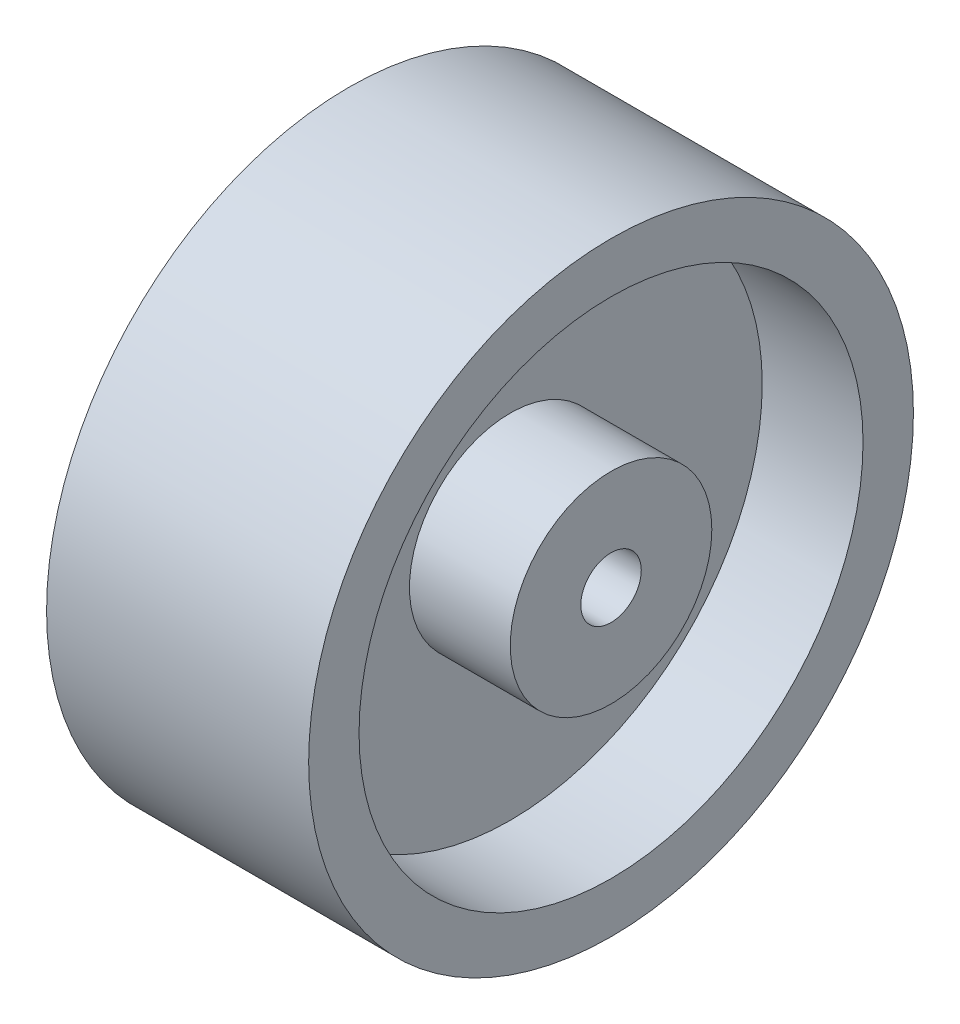
from build123d import *

# Parameters (mm, degrees)
SKETCH1_R           = 30
BOSS_EXTRUDE1_DEPTH = 25
CUT_EXTRUDE1_DEPTH  = 5
CIRPATTERN1_COUNT   = 6
CUT_EXTRUDE2_START  = -10
SKETCH3_R           = 25
SKETCH3_R_2         = 10
SKETCH3_R_3         = 3
CUT_EXTRUDE2_DEPTH  = 10
BOSS_EXTRUDE2_START = 1
SKETCH4_R           = 30
SKETCH4_R_2         = 27.021684923
BOSS_EXTRUDE2_DEPTH = 1


with BuildPart() as part:
    # Sketch1 → Boss-Extrude1 (new body)
    with BuildSketch(Plane(origin=(0, 0, 0), x_dir=(0, 0, -1), z_dir=(1, 0, 0))):
        Circle(SKETCH1_R)
    extrude(amount=BOSS_EXTRUDE1_DEPTH)

    # Sketch2 → Cut-Extrude1 (cut)
    with BuildSketch(Plane.ZY):
        with BuildLine():
            Line((0, 25), (0, 5))
            ThreePointArc((0, 5), (1.225953008, 4.847374467), (2.377061324, 4.398815689))
            Line((2.377061324, 4.398815689), (4.016525549, 24.675241083))
            Line((4.016525549, 24.675241083), (0, 25))
        make_face()
        with BuildLine():
            ThreePointArc((-2.377061324, 4.398815689), (-1.225953008, 4.847374467), (0, 5))
            Line((0, 5), (0, 25))
            Line((0, 25), (-4.016525549, 24.675241083))
            Line((-4.016525549, 24.675241083), (-2.377061324, 4.398815689))
        make_face()
        with BuildLine():
            ThreePointArc((4.016525549, 24.675241083), (2.014816731, 24.918678005), (0, 25))
            Line((0, 25), (4.016525549, 24.675241083))
        make_face()
        with BuildLine():
            Line((-4.016525549, 24.675241083), (0, 25))
            ThreePointArc((0, 25), (-2.014816731, 24.918678005), (-4.016525549, 24.675241083))
        make_face()
    cut_extrude1 = extrude(amount=-CUT_EXTRUDE1_DEPTH, mode=Mode.SUBTRACT)

    # CirPattern1: Cut-Extrude1 ×6 about axis
    cirpattern1_axis = Axis((0, -0.752840444, 0), (1, 0, 0))
    for i in range(1, CIRPATTERN1_COUNT):
        add(cut_extrude1.rotate(cirpattern1_axis, i * 360 / CIRPATTERN1_COUNT), mode=Mode.SUBTRACT)

    # Sketch3 → Cut-Extrude2 (cut)
    # profile 1 of 2: a face of its own
    with BuildSketch(Plane(origin=(25, 0, 0), x_dir=(0, 0, -1), z_dir=(1, 0, 0)).offset(CUT_EXTRUDE2_START)):
        Circle(SKETCH3_R)
        Circle(SKETCH3_R_2, mode=Mode.SUBTRACT)
    # profile 2 of 2: a face of its own
    with BuildSketch(Plane(origin=(25, 0, 0), x_dir=(0, 0, -1), z_dir=(1, 0, 0)).offset(CUT_EXTRUDE2_START)):
        Circle(SKETCH3_R_3)
    extrude(amount=CUT_EXTRUDE2_DEPTH, mode=Mode.SUBTRACT)

    # Sketch4 → Boss-Extrude2 (add)
    with BuildSketch(Plane.ZY.offset(BOSS_EXTRUDE2_START)):
        Circle(SKETCH4_R)
        Circle(SKETCH4_R_2, mode=Mode.SUBTRACT)
    extrude(amount=-BOSS_EXTRUDE2_DEPTH)


solid = part.part
